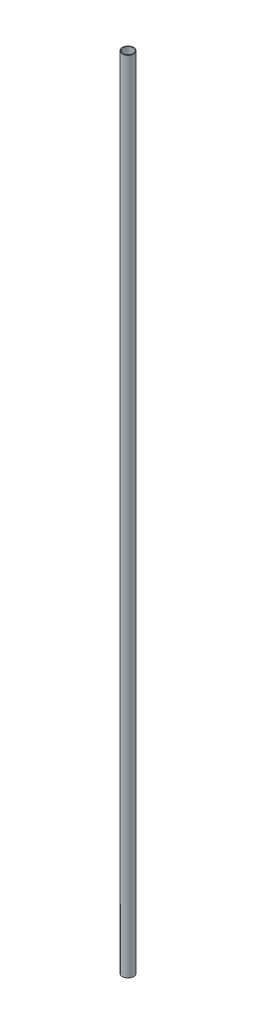
from build123d import *

# Parameters (mm, degrees)
SCHIZZO1_R                   = 8
SCHIZZO1_R_2                 = 7
ESTRUSIONE_ESTRUSIONE1_DEPTH = 1120


with BuildPart() as part:
    # Schizzo1 → Estrusione-Estrusione1 (new body)
    with BuildSketch(Plane(origin=(0, 0, 0), x_dir=(1, 0, 0), z_dir=(0, 1, 0))):
        with Locations(Location((0, 0, 0), (0, 0, 270))):
            Circle(SCHIZZO1_R)
        with Locations(Location((0, 0, 0), (0, 0, 270))):
            Circle(SCHIZZO1_R_2, mode=Mode.SUBTRACT)
    extrude(amount=ESTRUSIONE_ESTRUSIONE1_DEPTH)


solid = part.part
